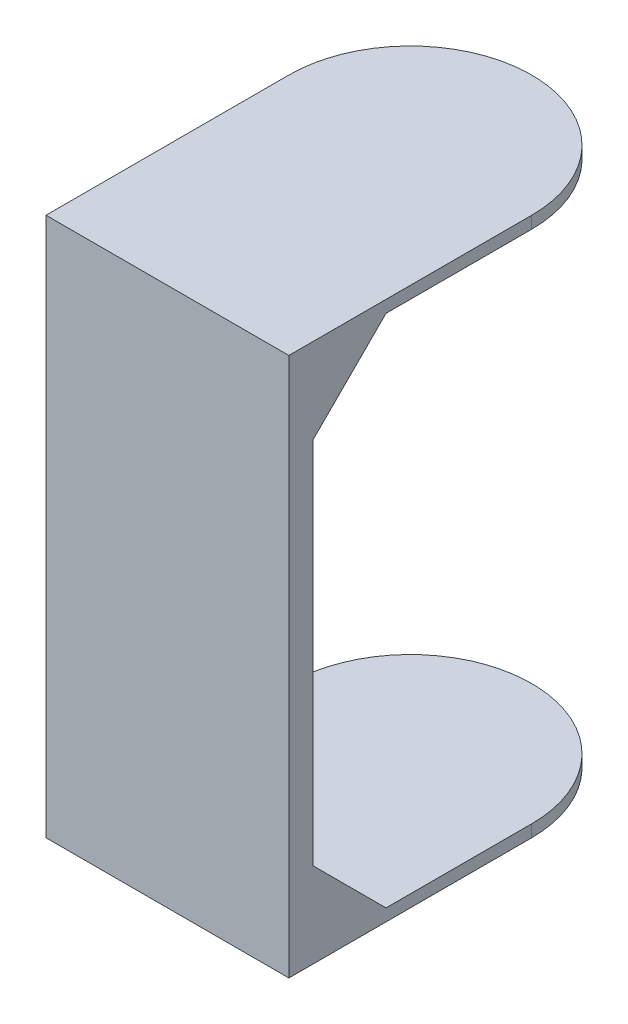
from build123d import *

# Parameters (mm, degrees)
PLATE_SKETCH_W                  = 100
PLATE_SKETCH_H                  = 212
PLATE_EXTRUDE_DEPTH             = 10
PRIMARY_SUPPORT_EXTRUDE_DEPTH   = 10
SECONDARY_SUPPORT_EXTRUDE_DEPTH = 10
GRIPPER_EXTRUDE_DEPTH           = 5


with BuildPart() as part:
    # Plate Sketch → Plate Extrude (new body)
    with BuildSketch(Plane.XY):
        Rectangle(PLATE_SKETCH_W, PLATE_SKETCH_H)
    extrude(amount=-PLATE_EXTRUDE_DEPTH)

    # Primary Support Sketch → Primary Support Extrude (add)
    with BuildSketch(Plane(origin=(50, 0, 0), x_dir=(0, 0, -1), z_dir=(1, 0, 0))):
        Polygon((10, 106), (10, 76), (40, 106), align=None)
    primary_support_extrude = extrude(amount=-PRIMARY_SUPPORT_EXTRUDE_DEPTH)

    # Primary Support Mirror: Primary Support Extrude across plane
    add(primary_support_extrude.mirror(Plane.ZX))

    # Secondary Support Sketch → Secondary Support Extrude (add)
    with BuildSketch(Plane.ZY.offset(50)):
        Polygon((-10, 76), (-40, 106), (-10, 106), align=None)
    extrude(amount=-SECONDARY_SUPPORT_EXTRUDE_DEPTH)

    # Gripper Sketch → Gripper Extrude (add)
    with BuildSketch(Plane(origin=(0, 106, 0), x_dir=(1, 0, 0), z_dir=(0, 1, 0))):
        with BuildLine():
            Line((-50, 0), (50, 0))
            Line((50, 0), (50, 100))
            ThreePointArc((50, 100), (0, 150), (-50, 100))
            Line((-50, 100), (-50, 0))
        make_face()
    gripper_extrude = extrude(amount=GRIPPER_EXTRUDE_DEPTH)

    # Gripper Mirror: Gripper Extrude across plane
    add(gripper_extrude.mirror(Plane.ZX))


solid = part.part
